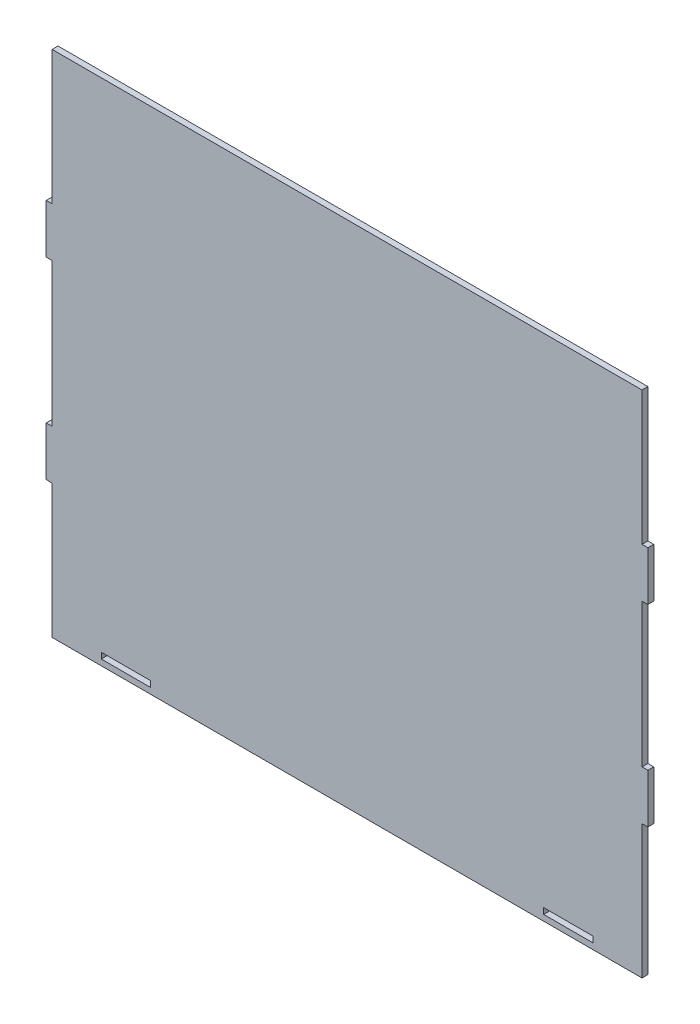
from build123d import *

# Parameters (mm, degrees)
SKETCH1_W           = 50
SKETCH1_H           = 6
BOSS_EXTRUDE1_DEPTH = 6


with BuildPart() as part:
    # Sketch1 → Boss-Extrude1 (new body)
    with BuildSketch(Plane.XY):
        Polygon((-300, 259), (300, 259), (300, 123), (306, 123), (306, 73), (300, 73), (300, -73), (306, -73), (306, -123), (300, -123), (300, -259), (-300, -259), (-300, -123), (-306, -123), (-306, -73), (-300, -73), (-300, 73), (-306, 73), (-306, 123), (-300, 123), align=None)
        with Locations((225, -250)):
            Rectangle(SKETCH1_W, SKETCH1_H, mode=Mode.SUBTRACT)
        with Locations((-225, -250)):
            Rectangle(SKETCH1_W, SKETCH1_H, mode=Mode.SUBTRACT)
    extrude(amount=BOSS_EXTRUDE1_DEPTH)


solid = part.part
